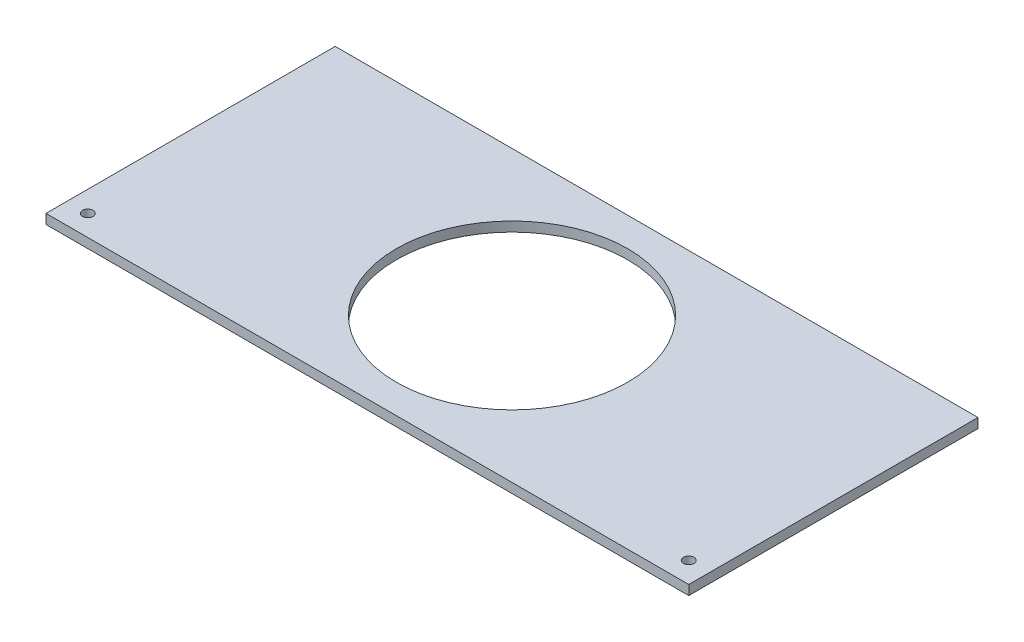
from build123d import *

# Parameters (mm, degrees)
SKETCH1_W           = 200
SKETCH1_H           = 90
SKETCH1_R           = 36
SKETCH1_R_2         = 1.65
BOSS_EXTRUDE1_DEPTH = 3


with BuildPart() as part:
    # Sketch1 → Boss-Extrude1 (new body)
    with BuildSketch(Plane(origin=(0, 0, 0), x_dir=(1, 0, 0), z_dir=(0, 1, 0))):
        with Locations((100, 45)):
            Rectangle(SKETCH1_W, SKETCH1_H)
        with Locations(Location((100, 45, 0), (0, 0, 270))):
            Circle(SKETCH1_R, mode=Mode.SUBTRACT)
        with Locations(Location((6.5, 6.5, 0), (0, 0, 270))):
            Circle(SKETCH1_R_2, mode=Mode.SUBTRACT)
        with Locations(Location((193.5, 6.5, 0), (0, 0, 270))):
            Circle(SKETCH1_R_2, mode=Mode.SUBTRACT)
    extrude(amount=BOSS_EXTRUDE1_DEPTH)


solid = part.part
